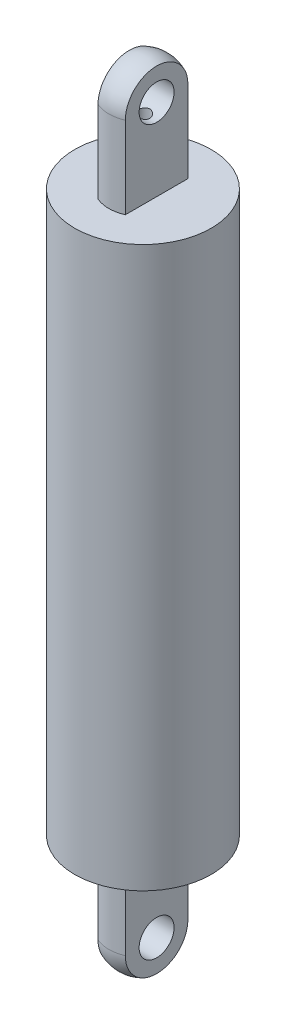
from build123d import *

# Parameters (mm, degrees)
CUT_EXTRUDE2_DEPTH = 64.503174921
SKETCH4_R          = 1.627
CUT_EXTRUDE3_DEPTH = 39.142309841


with BuildPart() as part:
    # Sketch1 → Revolve-Thin1 (revolve)
    with BuildSketch(Plane(origin=(0, 0, 0), x_dir=(0, 0, -1), z_dir=(1, 0, 0))):
        with BuildLine():
            ThreePointArc((0, 36.83), (-2.24506403, 35.90006403), (-3.175, 33.655))
            Line((-3.175, 33.655), (-3.175, 26.035))
            Line((-3.175, 26.035), (-6.35, 26.035))
            Line((-6.35, 26.035), (-6.35, -26.035))
            Line((-6.35, -26.035), (-3.175, -26.035))
            Line((-3.175, -26.035), (-3.175, -33.655))
            ThreePointArc((-3.175, -33.655), (-2.24506403, -35.90006403), (0, -36.83))
            Line((0, -36.83), (0, -34.29))
            ThreePointArc((0, -34.29), (-0.449012806, -34.104012806), (-0.635, -33.655))
            Line((-0.635, -33.655), (-0.635, -23.495))
            Line((-0.635, -23.495), (-3.81, -23.495))
            Line((-3.81, -23.495), (-3.81, 23.495))
            Line((-3.81, 23.495), (-0.635, 23.495))
            Line((-0.635, 23.495), (-0.635, 33.655))
            ThreePointArc((-0.635, 33.655), (-0.449012806, 34.104012806), (0, 34.29))
            Line((0, 34.29), (0, 36.83))
        make_face()
    revolve(axis=Axis((0, 33.655, 0), (0, -1, 0)))

    # Sketch3 → Cut-Extrude2 (cut, through all)
    with BuildSketch(Plane(origin=(0, 26.035, 0), x_dir=(1, 0, 0), z_dir=(0, 1, 0))):
        with BuildLine():
            ThreePointArc((-1.27, 2.909935566), (-3.175, 0), (-1.27, -2.909935566))
            Line((-1.27, -2.909935566), (-1.27, 2.909935566))
        make_face()
        with BuildLine():
            Line((1.27, 2.909935566), (1.27, -2.909935566))
            ThreePointArc((1.27, -2.909935566), (2.656395584, -1.73901912), (3.175, 0))
            ThreePointArc((3.175, 0), (2.656395584, 1.73901912), (1.27, 2.909935566))
        make_face()
    cut_extrude2 = extrude(amount=CUT_EXTRUDE2_DEPTH, mode=Mode.SUBTRACT)

    # Mirror1: Cut-Extrude2 across plane
    add(cut_extrude2.mirror(Plane.ZX), mode=Mode.SUBTRACT)

    # Sketch4 → Cut-Extrude3 (cut, through all)
    with BuildSketch(Plane(origin=(1.27, 0, 0), x_dir=(0, 0, -1), z_dir=(1, 0, 0))):
        with Locations((0, 33.655)):
            Circle(SKETCH4_R)
        with Locations((0, -33.655)):
            Circle(SKETCH4_R)
    extrude(amount=-CUT_EXTRUDE3_DEPTH, mode=Mode.SUBTRACT)


solid = part.part
